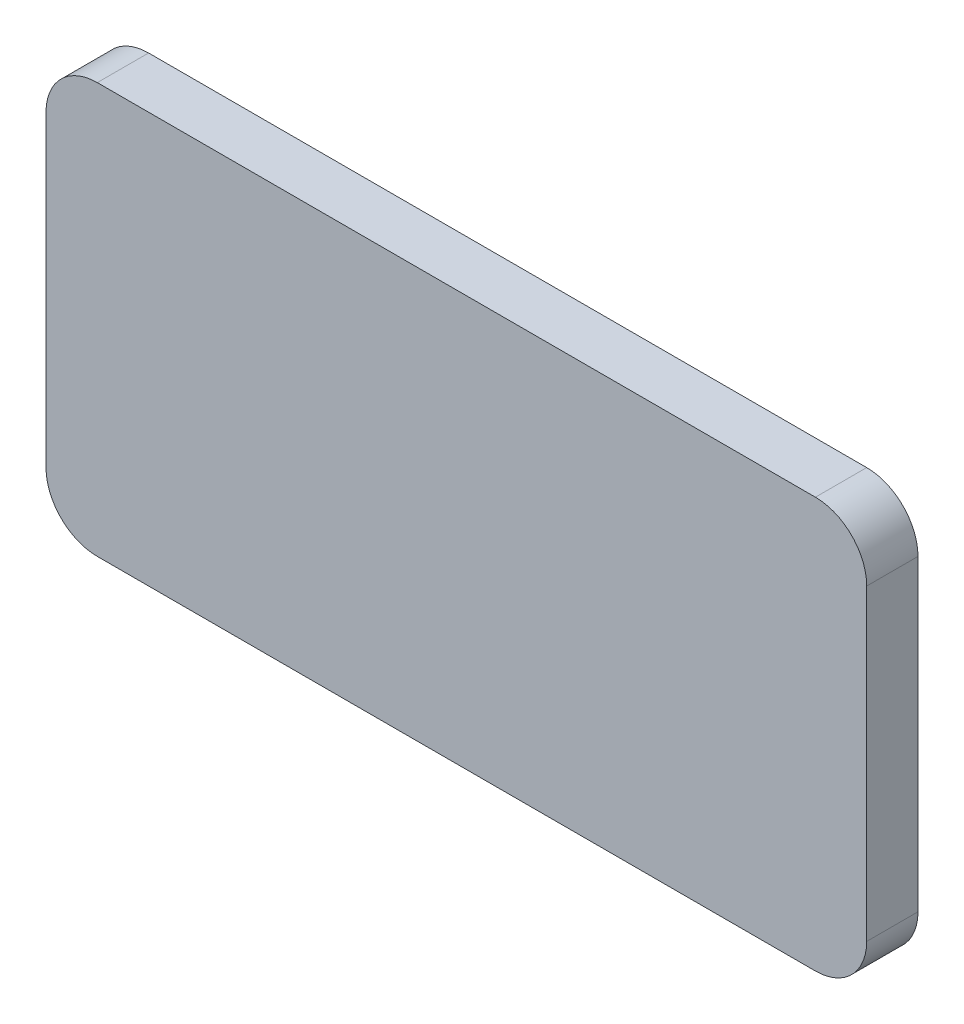
from build123d import *

# Parameters (mm, degrees)
EXTRUDE_1_DEPTH = 5


with BuildPart() as part:
    # 草圖1 → 填料-伸長1 (new body)
    with BuildSketch(Plane.XY):
        with BuildLine():
            Line((5, 0), (75, 0))
            ThreePointArc((75, 0), (78.535533906, 1.464466094), (80, 5))
            Line((80, 5), (80, 35))
            ThreePointArc((80, 35), (78.535533906, 38.535533906), (75, 40))
            Line((75, 40), (5, 40))
            ThreePointArc((5, 40), (1.464466094, 38.535533906), (0, 35))
            Line((0, 35), (0, 5))
            ThreePointArc((0, 5), (1.464466094, 1.464466094), (5, 0))
        make_face()
    extrude(amount=EXTRUDE_1_DEPTH)


solid = part.part
